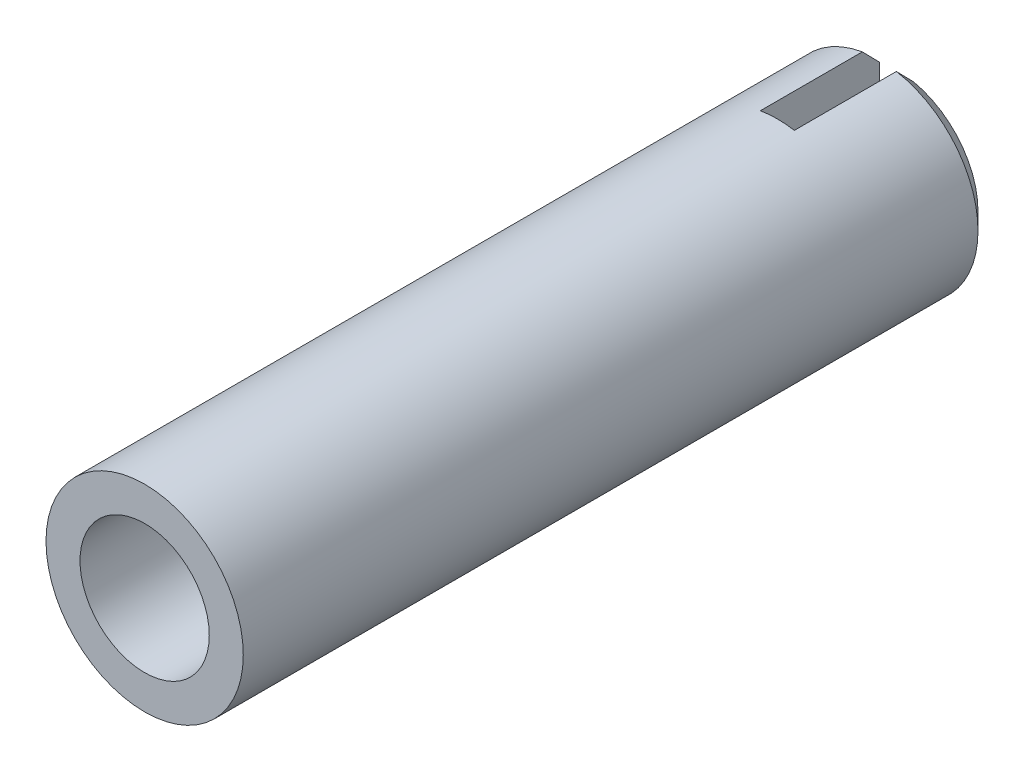
from build123d import *

# Parameters (mm, degrees)
SKETCH_1_R          = 2.9
SKETCH_1_R_2        = 1.9
EXTRUDE_1_DEPTH     = 22.1
CHAMFER_1_SIZE      = 0.5
SKETCH_3_W          = 1
SKETCH_3_H          = 1.984217256
CUT_EXTRUDE_1_DEPTH = 3.5


with BuildPart() as part:
    # 草图1 → 拉伸-薄壁1 (new body)
    with BuildSketch(Plane.XY):
        Circle(SKETCH_1_R)
        Circle(SKETCH_1_R_2, mode=Mode.SUBTRACT)
    extrude(amount=-EXTRUDE_1_DEPTH)

    # 倒角1
    chamfer_1_edges = [part.edges().sort_by_distance(p)[0] for p in [
        (-2.9, 0, -22.1),
    ]]
    chamfer(chamfer_1_edges, length=CHAMFER_1_SIZE)

    # 草图3 → 切除-拉伸1 (cut)
    with BuildSketch(Plane(origin=(0, 0, -22.1), x_dir=(-1, 0, 0), z_dir=(0, 0, -1))):
        with Locations((0, -2.273251869)):
            Rectangle(SKETCH_3_W, SKETCH_3_H)
        with Locations((0, 2.273251869)):
            Rectangle(SKETCH_3_W, SKETCH_3_H)
    extrude(amount=-CUT_EXTRUDE_1_DEPTH, mode=Mode.SUBTRACT)


solid = part.part
